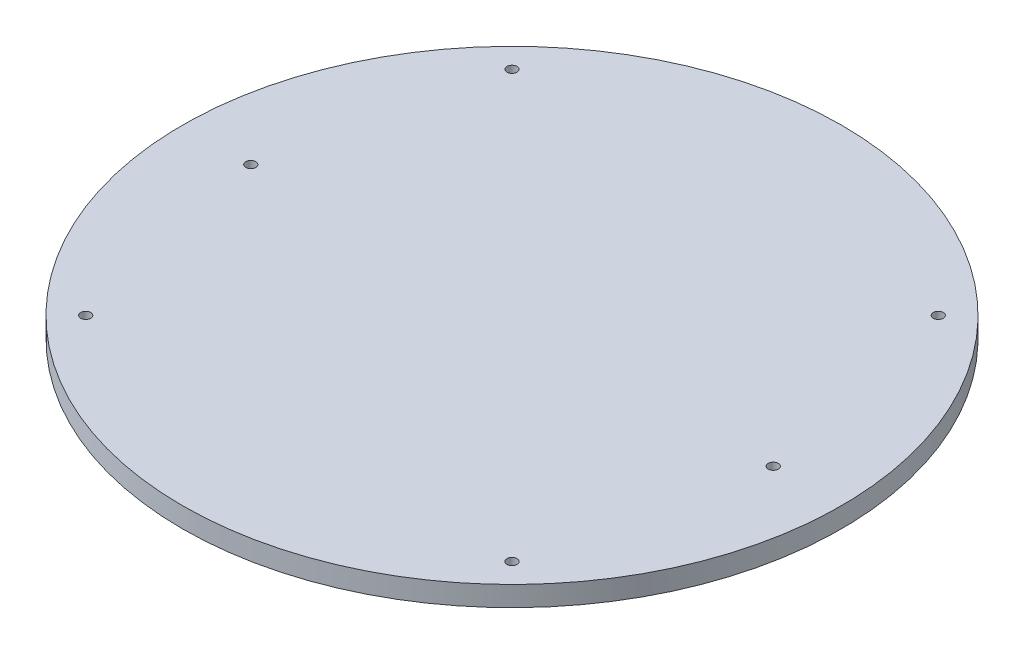
from build123d import *

# Parameters (mm, degrees)
SKETCH1_R           = 82
BOSS_EXTRUDE1_DEPTH = 5
SKETCH14_R          = 1.25
CUT_EXTRUDE2_DEPTH  = 133
SKETCH15_R          = 1.25
CUT_EXTRUDE3_DEPTH  = 10
CIRPATTERN1_COUNT   = 2


with BuildPart() as part:
    # Sketch1 → Boss-Extrude1 (new body)
    with BuildSketch(Plane(origin=(0, 0, 0), x_dir=(1, 0, 0), z_dir=(0, 1, 0))):
        with Locations(Location((0, 0, 0), (0, 0, 270))):
            Circle(SKETCH1_R)
    extrude(amount=BOSS_EXTRUDE1_DEPTH)

    # Sketch14 → Cut-Extrude2 (cut)
    with BuildSketch(Plane(origin=(0, 5, 0), x_dir=(1, 0, 0), z_dir=(0, 1, 0))):
        with Locations(Location((-53.033008589, 53.033008589, 0), (0, 0, 270))):
            Circle(SKETCH14_R)
        with Locations(Location((53.033008589, 53.033008589, 0), (0, 0, 270))):
            Circle(SKETCH14_R)
        with Locations(Location((53.033008589, -53.033008589, 0), (0, 0, 270))):
            Circle(SKETCH14_R)
        with Locations(Location((-53.033008589, -53.033008589, 0), (0, 0, 270))):
            Circle(SKETCH14_R)
    extrude(amount=-CUT_EXTRUDE2_DEPTH, mode=Mode.SUBTRACT)

    # Sketch15 → Cut-Extrude3 (cut)
    with BuildSketch(Plane(origin=(0, 5, 0), x_dir=(1, 0, 0), z_dir=(0, 1, 0))):
        with Locations(Location((-65, 0, 0), (0, 0, 270))):
            Circle(SKETCH15_R)
    cut_extrude3 = extrude(amount=-CUT_EXTRUDE3_DEPTH, mode=Mode.SUBTRACT)

    # CirPattern1: Cut-Extrude3 ×2 about axis
    cirpattern1_axis = Axis((0, 0, 0), (0, 1, 0))
    for i in range(1, CIRPATTERN1_COUNT):
        add(cut_extrude3.rotate(cirpattern1_axis, i * 360 / CIRPATTERN1_COUNT), mode=Mode.SUBTRACT)


solid = part.part
